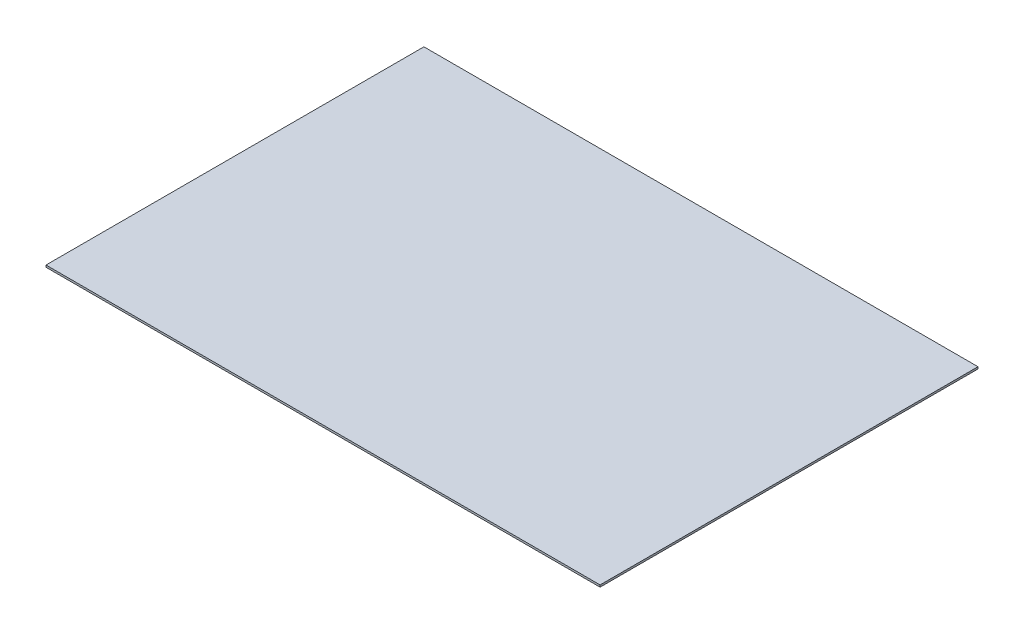
from build123d import *

# Parameters (mm, degrees)
SKETCH1_W           = 1787.525
SKETCH1_H           = 1219.2
BOSS_EXTRUDE1_DEPTH = 6.35


with BuildPart() as part:
    # Sketch1 → Boss-Extrude1 (new body)
    with BuildSketch(Plane(origin=(0, 0, 0), x_dir=(1, 0, 0), z_dir=(0, 1, 0))):
        Rectangle(SKETCH1_W, SKETCH1_H)
    extrude(amount=BOSS_EXTRUDE1_DEPTH)


solid = part.part
